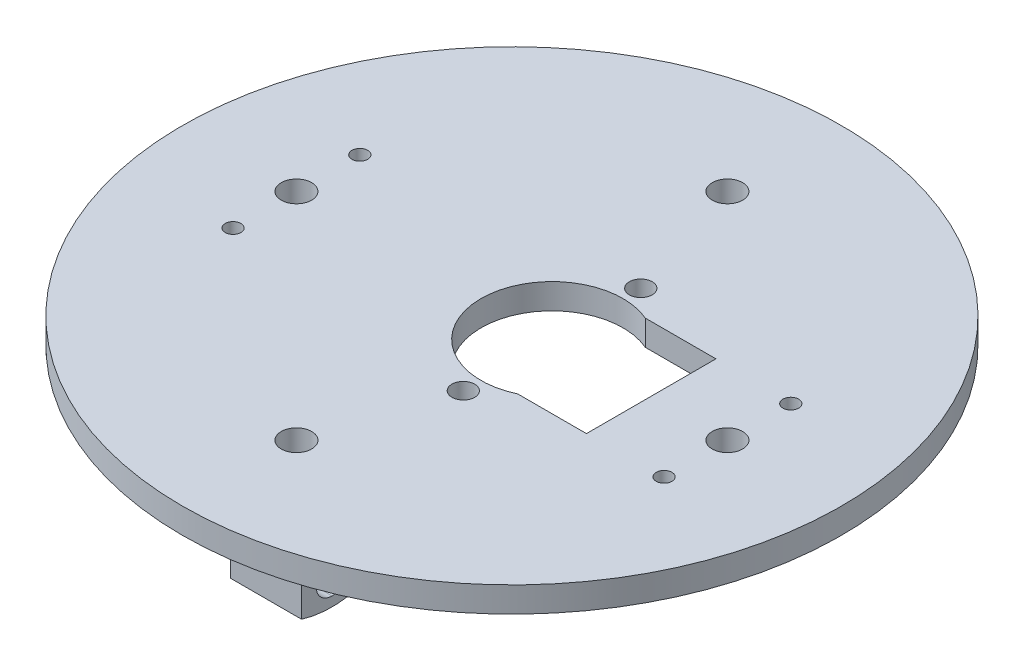
from build123d import *
from build123d.topology import SkipClean

# Parameters (mm, degrees)
SKETCH1_R           = 65
SKETCH1_R_2         = 5
SKETCH1_R_3         = 3
SKETCH1_R_4         = 1.55
BOSS_EXTRUDE1_DEPTH = 5
SKETCH2_R           = 14
CUT_EXTRUDE2_DEPTH  = 10
SKETCH3_R           = 2.25
SKETCH3_W           = 17.301764966
SKETCH3_H           = 25.534036418
CUT_EXTRUDE3_DEPTH  = 10
BOSS_EXTRUDE2_START = -27.5
SKETCH4_R           = 3
BOSS_EXTRUDE2_DEPTH = 22.5
SKETCH6_W           = 6
SKETCH6_H           = 20
CUT_EXTRUDE4_DEPTH  = 22.5
CUT_EXTRUDE5_REACH  = 101.575


with BuildPart() as part:
    # Sketch1 → Boss-Extrude1 (new body)
    with BuildSketch(Plane(origin=(0, 0, 0), x_dir=(1, 0, 0), z_dir=(0, 1, 0))):
        with Locations(Location((0, 0, 0), (0, 0, 270))):
            Circle(SKETCH1_R)
        with Locations(Location((0, 0, 0), (0, 0, 270))):
            Circle(SKETCH1_R_2, mode=Mode.SUBTRACT)
        with Locations(Location((0, 42.5, 0), (0, 0, 270))):
            Circle(SKETCH1_R_3, mode=Mode.SUBTRACT)
        with Locations(Location((42.5, 0, 0), (0, 0, 270))):
            Circle(SKETCH1_R_3, mode=Mode.SUBTRACT)
        with Locations(Location((0, -42.5, 0), (0, 0, 270))):
            Circle(SKETCH1_R_3, mode=Mode.SUBTRACT)
        with Locations(Location((-42.5, 0, 0), (0, 0, 270))):
            Circle(SKETCH1_R_3, mode=Mode.SUBTRACT)
        with Locations(Location((-42.5, -12.5, 0), (0, 0, 270))):
            Circle(SKETCH1_R_4, mode=Mode.SUBTRACT)
        with Locations(Location((-42.5, 12.5, 0), (0, 0, 270))):
            Circle(SKETCH1_R_4, mode=Mode.SUBTRACT)
        with Locations(Location((42.5, -12.5, 0), (0, 0, 90))):
            Circle(SKETCH1_R_4, mode=Mode.SUBTRACT)
        with Locations(Location((42.5, 12.5, 0), (0, 0, 90))):
            Circle(SKETCH1_R_4, mode=Mode.SUBTRACT)
    extrude(amount=BOSS_EXTRUDE1_DEPTH)

    # Sketch2 → Cut-Extrude2 (cut)
    with BuildSketch(Plane(origin=(0, 0, 0), x_dir=(-1, 0, 0), z_dir=(0, -1, 0))):
        with Locations(Location((-7.999467705, -0.092284522, 0), (0, 0, 90))):
            Circle(SKETCH2_R)
    extrude(amount=-CUT_EXTRUDE2_DEPTH, mode=Mode.SUBTRACT)

    # Sketch3 → Cut-Extrude3 (cut)
    with BuildSketch(Plane(origin=(0, 0, 0), x_dir=(-1, 0, 0), z_dir=(0, -1, 0))):
        with Locations(Location((-7.999467705, -17.592284522, 0), (0, 0, 90))):
            Circle(SKETCH3_R)
        with Locations(Location((-7.999467705, 17.407715478, 0), (0, 0, 90))):
            Circle(SKETCH3_R)
        with Locations((-18.812677283, 0)):
            Rectangle(SKETCH3_W, SKETCH3_H)
    extrude(amount=-CUT_EXTRUDE3_DEPTH, mode=Mode.SUBTRACT)

    # Sketch4 → Boss-Extrude2 (add)
    with BuildSketch(Plane(origin=(0, 5, 0), x_dir=(1, 0, 0), z_dir=(0, 1, 0)).offset(BOSS_EXTRUDE2_START)):
        Polygon((-7, 42.5), (-7, 22.5), (7, 22.5), (7, 42.5), (7, 48.5), (-7, 48.5), align=None)
        with Locations(Location((0, 42.5, 0), (0, 0, 270))):
            Circle(SKETCH4_R, mode=Mode.SUBTRACT)
    boss_extrude2 = extrude(amount=BOSS_EXTRUDE2_DEPTH)

    # Sketch6 → Cut-Extrude4 (cut)
    with BuildSketch(Plane(origin=(0, -22.5, 0), x_dir=(-1, 0, 0), z_dir=(0, -1, 0))):
        with Locations((0, 32.5)):
            Rectangle(SKETCH6_W, SKETCH6_H)
    cut_extrude4 = extrude(amount=-CUT_EXTRUDE4_DEPTH, mode=Mode.SUBTRACT)

    # Cut-Extrude5: up to this face of the body (flat: up to its plane)
    cut_extrude5_end = Plane(part.part.faces().sort_by_distance((-7, -11.25, -35.5))[0])
    # Sketch7 → Cut-Extrude5 (cut, up to the picked face)
    with BuildSketch(Plane(origin=(7, 0, 0), x_dir=(0, 0, -1), z_dir=(1, 0, 0)), mode=Mode.PRIVATE) as cut_extrude5_sk1:
        with BuildLine():
            Line((12.396013553, 0), (22.5, 0))
            ThreePointArc((22.5, 0), (30.667840434, -16.124515497), (48.5, -19.078784028))
            Line((48.5, -19.078784028), (48.5, -29.5))
            ThreePointArc((48.5, -29.5), (23.452348159, -23.31173437), (12.396013553, 0))
        make_face()
    cut_extrude5_tool1 = split(extrude(cut_extrude5_sk1.sketch, amount=-CUT_EXTRUDE5_REACH, mode=Mode.PRIVATE), bisect_by=cut_extrude5_end, keep=Keep.BOTH, mode=Mode.PRIVATE)
    # Sketch7 → Cut-Extrude5 (cut, up to the picked face)
    with BuildSketch(Plane(origin=(7, 0, 0), x_dir=(0, 0, -1), z_dir=(1, 0, 0)), mode=Mode.PRIVATE) as cut_extrude5_sk2:
        with BuildLine():
            ThreePointArc((42.5, -18.1), (45.6, -15), (42.5, -11.9))
            ThreePointArc((42.5, -11.9), (38.253817132, -11.116651072), (34.566666667, -8.869736311))
            ThreePointArc((34.566666667, -8.869736311), (30.189396423, -9.113673221), (30.433333333, -13.490943464))
            ThreePointArc((30.433333333, -13.490943464), (36.041520175, -16.908519697), (42.5, -18.1))
        make_face()
    cut_extrude5_tool2 = split(extrude(cut_extrude5_sk2.sketch, amount=-CUT_EXTRUDE5_REACH, mode=Mode.PRIVATE), bisect_by=cut_extrude5_end, keep=Keep.BOTH, mode=Mode.PRIVATE)
    cut_extrude5_1 = cut_extrude5_tool1.solids().sort_by(Axis((7, -17.317055, -28.895304), (-1, 0, 0)))[0]
    add(cut_extrude5_1, mode=Mode.SUBTRACT)
    cut_extrude5_2 = cut_extrude5_tool2.solids().sort_by(Axis((7, -13.514827, -37.337795), (-1, 0, 0)))[0]
    add(cut_extrude5_2, mode=Mode.SUBTRACT)
    cut_extrude5 = cut_extrude5_1 + cut_extrude5_2  # Cut-Extrude5 as one shape, for the pattern or mirror that repeats it

    # Mirror1: Boss-Extrude2, Cut-Extrude4, Cut-Extrude5 across plane
    with SkipClean():  # the faces are left unmerged after this step: merging them gives an invalid solid
        add(boss_extrude2.mirror(Plane.XY))
        add(cut_extrude4.mirror(Plane.XY), mode=Mode.SUBTRACT)
        add(cut_extrude5.mirror(Plane.XY), mode=Mode.SUBTRACT)


solid = part.part
